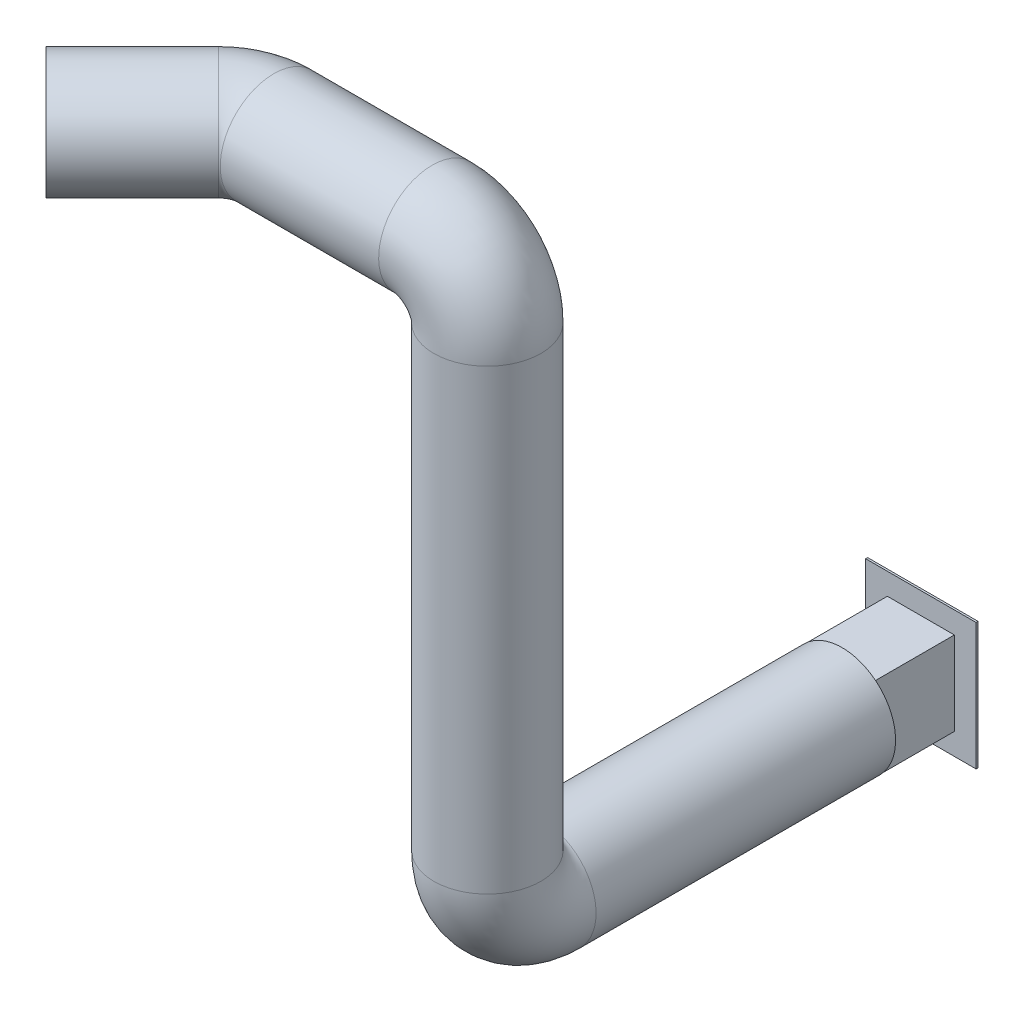
from build123d import *
from build123d.topology import SkipClean

# Parameters (mm, degrees)
CROQUIS1_W              = 140
CROQUIS1_H              = 161
CROQUIS1_W_2            = 80
CROQUIS1_H_2            = 101
SALIENTE_EXTRUIR1_DEPTH = 2.5
CROQUIS2_W              = 85
CROQUIS2_H              = 106
CROQUIS2_W_2            = 80
CROQUIS2_H_2            = 101
SALIENTE_EXTRUIR2_DEPTH = 100
CROQUIS3_R              = 67.935631299
SALIENTE_EXTRUIR3_DEPTH = 100
CROQUIS4_R              = 67.935631299


with BuildPart() as part:
    # Croquis1 → Saliente-Extruir1 (new body)
    with BuildSketch(Plane.XY):
        with Locations((70, -80.5)):
            Rectangle(CROQUIS1_W, CROQUIS1_H)
        with Locations((70, -80.5)):
            Rectangle(CROQUIS1_W_2, CROQUIS1_H_2, mode=Mode.SUBTRACT)
    extrude(amount=SALIENTE_EXTRUIR1_DEPTH)

    # Croquis2 → Saliente-Extruir2 (add)
    with BuildSketch(Plane.XY.offset(2.5)):
        with Locations((70, -80.5)):
            Rectangle(CROQUIS2_W, CROQUIS2_H)
        with Locations((70, -80.5)):
            Rectangle(CROQUIS2_W_2, CROQUIS2_H_2, mode=Mode.SUBTRACT)
    extrude(amount=SALIENTE_EXTRUIR2_DEPTH)

    # Croquis3 → Saliente-Extruir3 (add)
    with BuildSketch(Plane.XY.offset(102.5)):
        with Locations(Location((70, -80.5, 0), (0, 0, 128.725665443))):
            Circle(CROQUIS3_R)
    extrude(amount=SALIENTE_EXTRUIR3_DEPTH)

    # Barrer1: sweep along a curve in space
    with SkipClean():  # the faces are left unmerged after this step: merging them gives an invalid solid
        with BuildLine() as barrer1_path:
            Line((70, -80.5, 202.5), (70, -80.5, 482.5))
            ThreePointArc((70, -80.5, 482.5), (70, -59.997474683, 531.997474683), (70, -10.5, 552.5))
            Line((70, -10.5, 552.5), (70, 569.5, 552.5))
            ThreePointArc((70, 569.5, 552.5), (49.497474683, 618.997474683, 552.5), (0, 639.5, 552.5))
            Line((0, 639.5, 552.5), (-201.005050634, 639.5, 552.5))
            ThreePointArc((-201.005050634, 639.5, 552.5), (-227.792890899, 639.5, 557.828432724), (-250.502525317, 639.5, 573.002525317))
            Line((-360, 639.5, 682.5), (-250.502525317, 639.5, 573.002525317))
        # Croquis4 → Barrer1 (sweep)
        with BuildSketch(Plane.XY.offset(202.5)):
            with Locations((70, -80.5)):
                Circle(CROQUIS4_R)
        sweep(path=barrer1_path.line)


solid = part.part
